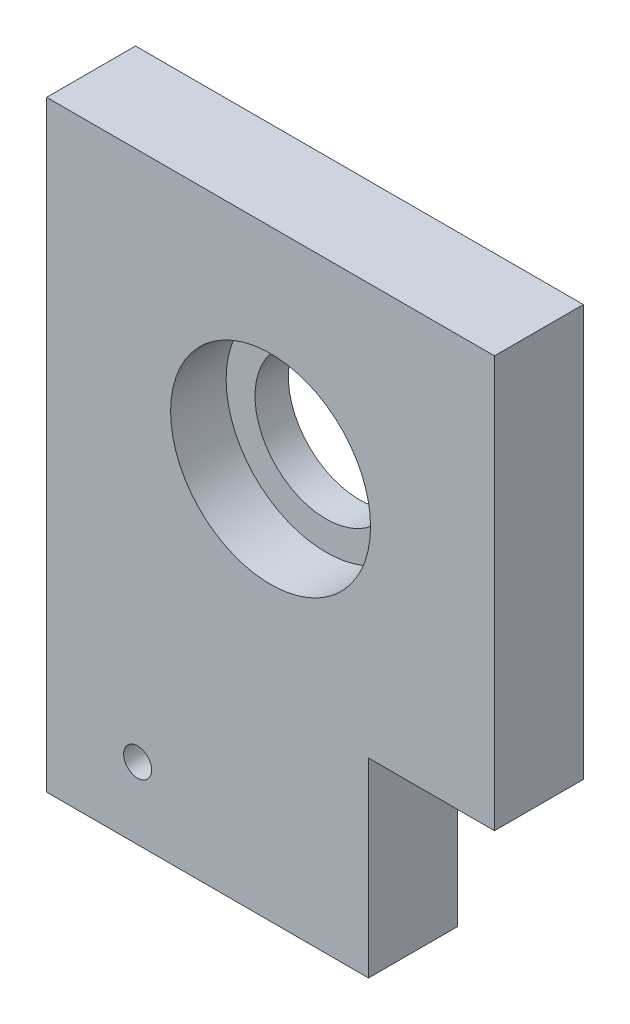
from build123d import *

# Parameters (mm, degrees)
SKETCH1_R           = 10.16
SKETCH1_R_2         = 2
BOSS_EXTRUDE1_DEPTH = 12.7
CUT_EXTRUDE1_START  = 12.7
SKETCH2_R           = 14.2875
CUT_EXTRUDE1_DEPTH  = 7.9375


with BuildPart() as part:
    # Sketch1 → Boss-Extrude1 (new body)
    with BuildSketch(Plane.XY):
        Polygon((14, -56), (-32, -56), (-32, 0), (-32, 30), (32, 30), (32, -28.77498914), (14, -28.77498914), align=None)
        Circle(SKETCH1_R, mode=Mode.SUBTRACT)
        with Locations((-19, -45.77498914)):
            Circle(SKETCH1_R_2, mode=Mode.SUBTRACT)
    extrude(amount=BOSS_EXTRUDE1_DEPTH)

    # Sketch2 → Cut-Extrude1 (cut)
    with BuildSketch(Plane.XY.offset(CUT_EXTRUDE1_START)):
        Circle(SKETCH2_R)
    extrude(amount=-CUT_EXTRUDE1_DEPTH, mode=Mode.SUBTRACT)


solid = part.part
